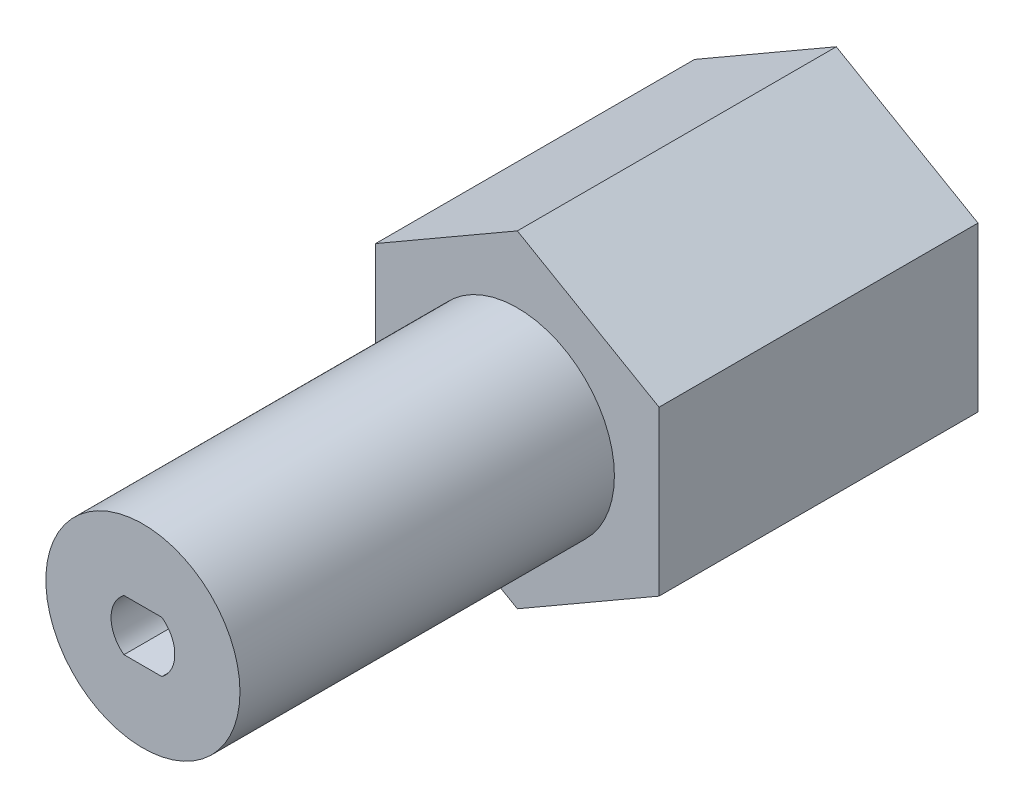
from build123d import *

# Parameters (mm, degrees)
BOSS_EXTRUDE1_DEPTH = 11.5
SKETCH2_R           = 3.5
BOSS_EXTRUDE2_DEPTH = 13.5
CUT_EXTRUDE2_DEPTH  = 27.190026728


with BuildPart() as part:
    # Sketch1 → Boss-Extrude1 (new body)
    with BuildSketch(Plane.XY):
        Polygon((5.109549882, -2.95), (5.109549882, 2.95), (0, 5.9), (-5.109549882, 2.95), (-5.109549882, -2.95), (0, -5.9), align=None)
    extrude(amount=BOSS_EXTRUDE1_DEPTH)

    # Sketch2 → Boss-Extrude2 (add)
    with BuildSketch(Plane.XY.offset(11.5)):
        Circle(SKETCH2_R)
    extrude(amount=BOSS_EXTRUDE2_DEPTH)

    # Sketch4 → Cut-Extrude2 (cut, through all)
    with BuildSketch(Plane.XY.offset(25)):
        with BuildLine():
            Line((-0.683282518, 0.925), (0.683282518, 0.925))
            ThreePointArc((0.683282518, 0.925), (1.15, 0), (0.683282518, -0.925))
            Line((0.683282518, -0.925), (-0.683282518, -0.925))
            ThreePointArc((-0.683282518, -0.925), (-1.15, 0), (-0.683282518, 0.925))
        make_face()
    extrude(amount=-CUT_EXTRUDE2_DEPTH, mode=Mode.SUBTRACT)


solid = part.part
